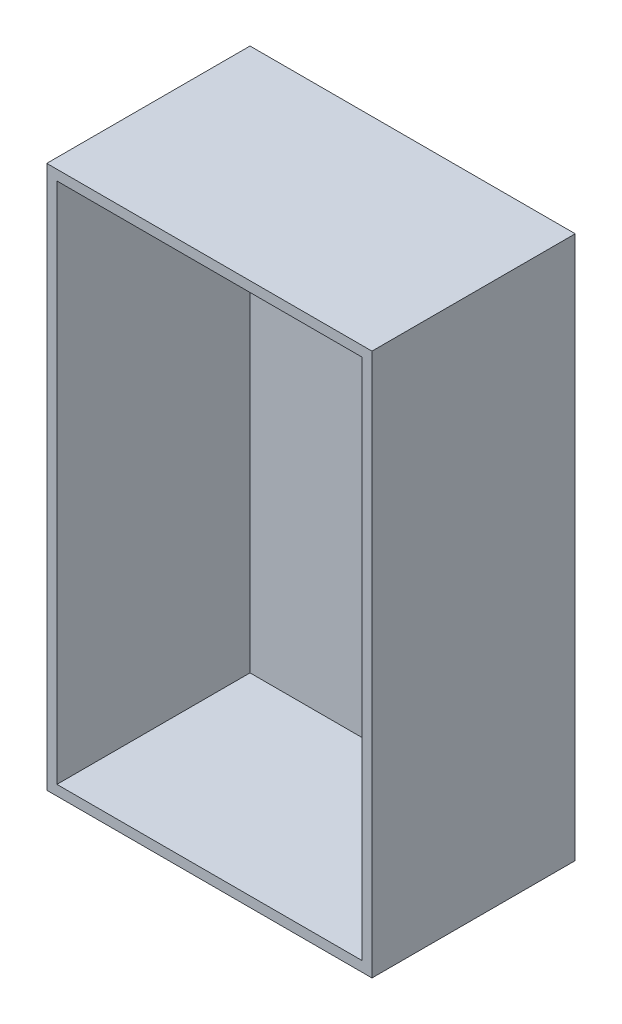
from build123d import *

# Parameters (mm, degrees)
SKETCH1_W           = 64
SKETCH1_H           = 106.838
BOSS_EXTRUDE1_DEPTH = 2
SKETCH1_3_W         = 64
SKETCH1_3_H         = 106.838
SKETCH1_3_W_2       = 60
SKETCH1_3_H_2       = 102.838
BOSS_EXTRUDE2_DEPTH = 40


with BuildPart() as part:
    # Sketch1 → Boss-Extrude1 (new body)
    with BuildSketch(Plane.XY):
        with Locations((32, 47)):
            Rectangle(SKETCH1_W, SKETCH1_H)
    extrude(amount=BOSS_EXTRUDE1_DEPTH)

    # Sketch1<3> → Boss-Extrude2 (add)
    with BuildSketch(Plane.XY):
        with Locations((32, 47)):
            Rectangle(SKETCH1_3_W, SKETCH1_3_H)
        with Locations((32, 47)):
            Rectangle(SKETCH1_3_W_2, SKETCH1_3_H_2, mode=Mode.SUBTRACT)
    extrude(amount=BOSS_EXTRUDE2_DEPTH)


solid = part.part
